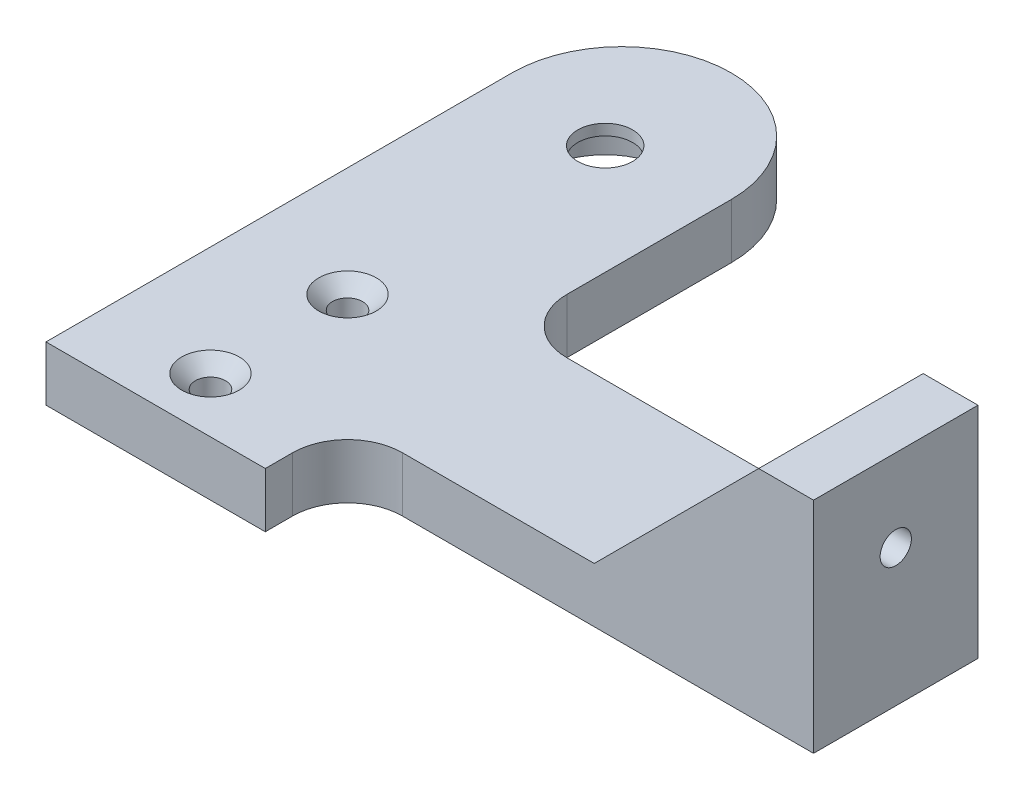
from build123d import *

# Parameters (mm, degrees)
SKETCH1_R           = 2.75
SKETCH1_R_2         = 12.1
BOSS_EXTRUDE1_DEPTH = 8
SKETCH3_R           = 2.75
SKETCH3_R_2         = 5
BOSS_EXTRUDE3_DEPTH = 2
BOSS_EXTRUDE4_DEPTH = 15
FILLET1_R           = 10
SKETCH5_R           = 2.85
CUT_EXTRUDE1_DEPTH  = 40
BOSS_EXTRUDE5_DEPTH = 5
CHAMFER1_SIZE       = 2.5


with BuildPart() as part:
    # Sketch1 → Boss-Extrude1 (new body)
    with BuildSketch(Plane(origin=(0, 0, 0), x_dir=(1, 0, 0), z_dir=(0, 1, 0))):
        with BuildLine():
            Line((-20, 0), (20, 0))
            Line((20, 0), (20, 85))
            ThreePointArc((20, 85), (0, 105), (-20, 85))
            Line((-20, 85), (-20, 0))
        make_face()
        with Locations(Location((0, 10, 0), (0, 0, 270))):
            Circle(SKETCH1_R, mode=Mode.SUBTRACT)
        with Locations(Location((0, 82, 0), (0, 0, 270))):
            Circle(SKETCH1_R_2, mode=Mode.SUBTRACT)
        with Locations(Location((0, 35, 0), (0, 0, 270))):
            Circle(SKETCH1_R, mode=Mode.SUBTRACT)
    extrude(amount=BOSS_EXTRUDE1_DEPTH)

    # Sketch3 → Boss-Extrude3 (add)
    with BuildSketch(Plane(origin=(0, 8, 0), x_dir=(1, 0, 0), z_dir=(0, 1, 0))):
        with BuildLine():
            Line((-20, 0), (20, 0))
            Line((20, 0), (20, 85))
            ThreePointArc((20, 85), (0, 105), (-20, 85))
            Line((-20, 85), (-20, 0))
        make_face()
        with Locations(Location((0, 10, 0), (0, 0, 270))):
            Circle(SKETCH3_R, mode=Mode.SUBTRACT)
        with Locations(Location((0, 35, 0), (0, 0, 270))):
            Circle(SKETCH3_R, mode=Mode.SUBTRACT)
        with Locations(Location((0, 82, 0), (0, 0, 270))):
            Circle(SKETCH3_R_2, mode=Mode.SUBTRACT)
    extrude(amount=BOSS_EXTRUDE3_DEPTH)

    # Sketch4 → Boss-Extrude4 (add, symmetric)
    with BuildSketch(Plane.XY.offset(-30)):
        Polygon((20, 0), (105, 0), (105, 40), (95, 40), (95, 13.535533906), (91.464466094, 10), (20, 10), align=None)
    extrude(amount=BOSS_EXTRUDE4_DEPTH, both=True)

    # Fillet1
    fillet1_edges = [part.edges().sort_by_distance(p)[0] for p in [
        (20, 5, -45),
        (20, 5, -15),
    ]]
    fillet(fillet1_edges, radius=FILLET1_R)

    # Sketch5 → Cut-Extrude1 (cut)
    with BuildSketch(Plane(origin=(105, 0, 0), x_dir=(0, 0, -1), z_dir=(1, 0, 0))):
        with Locations(Location((30, 25, 0), (0, 0, 90))):
            Circle(SKETCH5_R)
    extrude(amount=-CUT_EXTRUDE1_DEPTH, mode=Mode.SUBTRACT)

    # Sketch6 → Boss-Extrude5 (add)
    with BuildSketch(Plane.XY.offset(-15)):
        Polygon((65, 10), (95, 10), (95, 40), align=None)
    boss_extrude5 = extrude(amount=-BOSS_EXTRUDE5_DEPTH)

    # Mirror1: Boss-Extrude5 across plane
    add(boss_extrude5.mirror(Plane.XY.offset(-30)))

    # Chamfer1
    chamfer1_edges = [part.edges().sort_by_distance(p)[0] for p in [
        (0, 10, -12.75),
        (0, 10, -37.75),
    ]]
    chamfer(chamfer1_edges, length=CHAMFER1_SIZE)


solid = part.part
